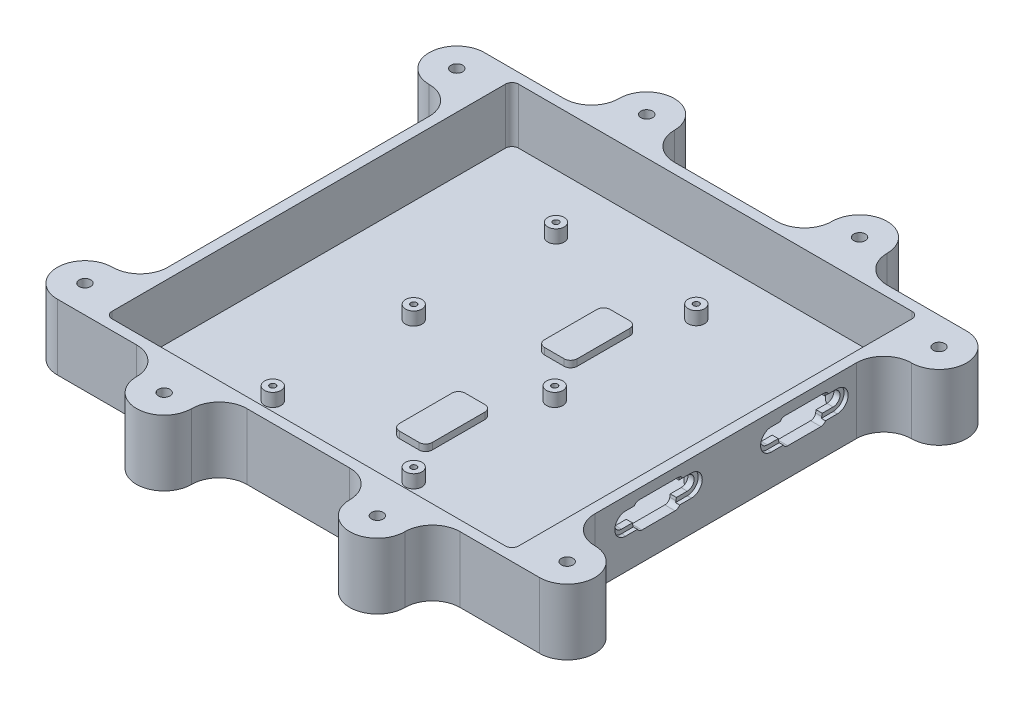
from build123d import *

# Parameters (mm, degrees)
SKETCH1_W                 = 165.1
SKETCH1_H                 = 165.1
BOSS_EXTRUDE1_DEPTH       = 25.4
SHELL1_T                  = -3.9624
SKETCH4_R                 = 3.175
BOSS_EXTRUDE2_DEPTH       = 5.08
FILLET1_R                 = 2.54
BOSS_EXTRUDE3_DEPTH       = 25.4
SKETCH77_W                = 12.7
SKETCH77_H                = 25.4
BOSS_EXTRUDE5_DEPTH       = 2.54
FILLET27_R                = 2.54
F_4_40_TAPPED_HOLE1_D     = 2.2606
F_4_40_TAPPED_HOLE1_DEPTH = 6.35
F_4_40_TAPPED_HOLE1_TIP   = 0.679152758
CUT_EXTRUDE6_DEPTH        = 3.9624
CUT_EXTRUDE7_DEPTH        = 3.9624
CUT_EXTRUDE8_DEPTH        = 1.5875
F_8_CLEARANCE_HOLE1_D     = 4.4958
F_8_CLEARANCE_HOLE1_DEPTH = 8.89
F_8_CLEARANCE_HOLE1_TIP   = 1.350674586


with BuildPart() as part:
    # Sketch1 → Boss-Extrude1 (new body)
    with BuildSketch(Plane(origin=(0, 0, 0), x_dir=(1, 0, 0), z_dir=(0, 1, 0))):
        with Locations((82.55, 82.55)):
            Rectangle(SKETCH1_W, SKETCH1_H)
    extrude(amount=BOSS_EXTRUDE1_DEPTH)

    # Shell1
    shell1_openings = [part.faces().sort_by_distance(p)[0] for p in [
        (82.55, 25.4, -82.55),
    ]]
    offset(amount=SHELL1_T, openings=shell1_openings, kind=Kind.INTERSECTION)

    # Sketch4 → Boss-Extrude2 (add)
    with BuildSketch(Plane(origin=(0, 3.9624, 0), x_dir=(1, 0, 0), z_dir=(0, 1, 0))):
        with Locations(Location((43.589230059, 29.02204, 0), (0, 0, 90))):
            Circle(SKETCH4_R)
        with Locations(Location((98.08718, 29.02204, 0), (0, 0, 90))):
            Circle(SKETCH4_R)
        with Locations(Location((152.58796, 29.02204, 0), (0, 0, 90))):
            Circle(SKETCH4_R)
        with Locations(Location((152.58796, 83.52282, 0), (0, 0, 90))):
            Circle(SKETCH4_R)
        with Locations(Location((43.589230059, 83.52282, 0), (0, 0, 90))):
            Circle(SKETCH4_R)
        with Locations(Location((98.08718, 83.52282, 0), (0, 0, 90))):
            Circle(SKETCH4_R)
        with Locations(Location((152.58796, 138.27252, 0), (0, 0, 90))):
            Circle(SKETCH4_R)
        with Locations(Location((98.08718, 138.27252, 0), (0, 0, 90))):
            Circle(SKETCH4_R)
        with Locations(Location((43.589230059, 138.52398, 0), (0, 0, 90))):
            Circle(SKETCH4_R)
    extrude(amount=BOSS_EXTRUDE2_DEPTH)

    # Fillet1
    fillet1_edges = [part.edges().sort_by_distance(p)[0] for p in [
        (3.9624, 14.6812, -161.1376),
        (3.9624, 14.6812, -3.9624),
        (161.1376, 14.6812, -3.9624),
        (161.1376, 14.6812, -161.1376),
    ]]
    fillet(fillet1_edges, radius=FILLET1_R)

    # Sketch5 → Boss-Extrude3 (add)
    with BuildSketch(Plane.XZ):
        with BuildLine():
            ThreePointArc((175.768, -21.336), (186.436, -10.668), (175.768, 0))
            Line((175.768, 0), (165.1, 0))
            Line((165.1, 0), (165.1, -32.004))
            ThreePointArc((165.1, -32.004), (168.224584858, -24.460584858), (175.768, -21.336))
        make_face()
        with BuildLine():
            Line((0, 0), (-10.668, 0))
            ThreePointArc((-10.668, 0), (-21.336, -10.668), (-10.668, -21.336))
            ThreePointArc((-10.668, -21.336), (-3.124584858, -24.460584858), (0, -32.004))
            Line((0, -32.004), (0, 0))
        make_face()
        with BuildLine():
            ThreePointArc((-10.668, -143.764), (-21.336, -154.432), (-10.668, -165.1))
            Line((-10.668, -165.1), (0, -165.1))
            Line((0, -165.1), (0, -133.096))
            ThreePointArc((0, -133.096), (-3.124584858, -140.639415142), (-10.668, -143.764))
        make_face()
        with BuildLine():
            Line((165.1, -165.1), (175.768, -165.1))
            ThreePointArc((175.768, -165.1), (186.436, -154.432), (175.768, -143.764))
            ThreePointArc((175.768, -143.764), (168.224584858, -140.639415142), (165.1, -133.096))
            Line((165.1, -133.096), (165.1, -165.1))
        make_face()
        with BuildLine():
            ThreePointArc((30.607, 10.668), (27.482415142, 3.124584858), (19.939, 0))
            Line((19.939, 0), (62.611, 0))
            ThreePointArc((62.611, 0), (55.067584858, 3.124584858), (51.943, 10.668))
            ThreePointArc((51.943, 10.668), (41.275, 21.336), (30.607, 10.668))
        make_face()
        with BuildLine():
            ThreePointArc((113.03, 10.668), (109.905415142, 3.124584858), (102.362, 0))
            Line((102.362, 0), (145.034, 0))
            ThreePointArc((145.034, 0), (137.490584858, 3.124584858), (134.366, 10.668))
            ThreePointArc((134.366, 10.668), (123.698, 21.336), (113.03, 10.668))
        make_face()
        with BuildLine():
            ThreePointArc((134.366, -175.768), (137.490584858, -168.224584858), (145.034, -165.1))
            Line((145.034, -165.1), (102.362, -165.1))
            ThreePointArc((102.362, -165.1), (109.905415142, -168.224584858), (113.03, -175.768))
            ThreePointArc((113.03, -175.768), (123.698, -186.436), (134.366, -175.768))
        make_face()
        with BuildLine():
            ThreePointArc((52.07, -175.768), (55.194584858, -168.224584858), (62.738, -165.1))
            Line((62.738, -165.1), (20.066, -165.1))
            ThreePointArc((20.066, -165.1), (27.609415142, -168.224584858), (30.734, -175.768))
            ThreePointArc((30.734, -175.768), (41.402, -186.436), (52.07, -175.768))
        make_face()
    extrude(amount=-BOSS_EXTRUDE3_DEPTH)

    # Sketch77 → Boss-Extrude5 (add)
    with BuildSketch(Plane(origin=(0, 3.9624, 0), x_dir=(1, 0, 0), z_dir=(0, 1, 0))):
        with Locations((84.52866, 53.55082)):
            Rectangle(SKETCH77_W, SKETCH77_H)
        with Locations((84.52866, 109.601)):
            Rectangle(SKETCH77_W, SKETCH77_H)
    extrude(amount=BOSS_EXTRUDE5_DEPTH)

    # Fillet27
    fillet27_edges = [part.edges().sort_by_distance(p)[0] for p in [
        (78.17866, 5.2324, -66.25082),
        (78.17866, 5.2324, -40.85082),
        (90.87866, 5.2324, -40.85082),
        (90.87866, 5.2324, -66.25082),
        (78.17866, 5.2324, -122.301),
        (78.17866, 5.2324, -96.901),
        (90.87866, 5.2324, -96.901),
        (90.87866, 5.2324, -122.301),
    ]]
    fillet(fillet27_edges, radius=FILLET27_R)

    # #4-40 Tapped Hole1
    with Locations(Plane(origin=(0, 9.0424, 0), x_dir=(1, 0, 0), z_dir=(0, 1, 0))):
        with Locations((152.58796, 29.02204), (152.58796, 83.52282), (152.58796, 138.27252), (98.08718, 138.27252), (98.08718, 83.52282), (98.08718, 29.02204), (43.589230059, 29.02204), (43.589230059, 83.52282), (43.589230059, 138.52398)):
            Hole(F_4_40_TAPPED_HOLE1_D / 2, depth=F_4_40_TAPPED_HOLE1_DEPTH)
            with Locations((0, 0, -(F_4_40_TAPPED_HOLE1_DEPTH + F_4_40_TAPPED_HOLE1_TIP / 2))):  # 118° drill point
                Cone(0, F_4_40_TAPPED_HOLE1_D / 2, F_4_40_TAPPED_HOLE1_TIP, mode=Mode.SUBTRACT)

    # Sketch86 → Cut-Extrude6 (cut)
    with BuildSketch(Plane(origin=(165.1, 0, 0), x_dir=(0, 0, -1), z_dir=(1, 0, 0))):
        with BuildLine():
            Line((50.240011813, 10.88644), (63.043988187, 10.88644))
            ThreePointArc((63.043988187, 10.88644), (64.296254152, 11.342227537), (64.962570955, 12.496322093))
            Line((64.962570955, 12.496322093), (66.146292768, 19.209542093))
            ThreePointArc((66.146292768, 19.209542093), (65.720102463, 20.800105965), (64.22771, 21.49602))
            Line((64.22771, 21.49602), (49.05629, 21.49602))
            ThreePointArc((49.05629, 21.49602), (47.563897537, 20.800105965), (47.137707232, 19.209542093))
            Line((47.137707232, 19.209542093), (48.321429045, 12.496322093))
            ThreePointArc((48.321429045, 12.496322093), (48.987745848, 11.342227537), (50.240011813, 10.88644))
        make_face()
    cut_extrude6 = extrude(amount=-CUT_EXTRUDE6_DEPTH, mode=Mode.SUBTRACT)

    # Sketch87 → Cut-Extrude7 (cut)
    with BuildSketch(Plane(origin=(165.1, 0, 0), x_dir=(0, 0, -1), z_dir=(1, 0, 0))):
        with BuildLine():
            Line((43.942, 18.85823), (69.342, 18.85823))
            ThreePointArc((69.342, 18.85823), (72.009, 16.19123), (69.342, 13.52423))
            Line((69.342, 13.52423), (43.942, 13.52423))
            ThreePointArc((43.942, 13.52423), (41.275, 16.19123), (43.942, 18.85823))
        make_face()
    cut_extrude7 = extrude(amount=-CUT_EXTRUDE7_DEPTH, mode=Mode.SUBTRACT)

    # Sketch88 → Cut-Extrude8 (cut)
    with BuildSketch(Plane(origin=(165.1, 0, 0), x_dir=(0, 0, -1), z_dir=(1, 0, 0))):
        with BuildLine():
            Line((43.942, 20.40763), (69.342, 20.40763))
            ThreePointArc((69.342, 20.40763), (73.5584, 16.19123), (69.342, 11.97483))
            Line((69.342, 11.97483), (43.942, 11.97483))
            ThreePointArc((43.942, 11.97483), (39.7256, 16.19123), (43.942, 20.40763))
        make_face()
    cut_extrude8 = extrude(amount=-CUT_EXTRUDE8_DEPTH, mode=Mode.SUBTRACT)

    # Mirror1: Cut-Extrude6, Cut-Extrude7, Cut-Extrude8 across plane
    add(cut_extrude6.mirror(Plane.XY.offset(-84.836)), mode=Mode.SUBTRACT)
    add(cut_extrude7.mirror(Plane.XY.offset(-84.836)), mode=Mode.SUBTRACT)
    add(cut_extrude8.mirror(Plane.XY.offset(-84.836)), mode=Mode.SUBTRACT)

    # #8 Clearance Hole1
    with Locations(Plane(origin=(0, 25.4, 0), x_dir=(1, 0, 0), z_dir=(0, 1, 0))):
        with Locations((41.402, 175.768), (123.698, 175.768), (175.768, 154.432), (175.768, 10.668), (123.698, -10.668), (41.275, -10.668), (-10.668, 10.668), (-10.668, 154.432)):
            Hole(F_8_CLEARANCE_HOLE1_D / 2, depth=F_8_CLEARANCE_HOLE1_DEPTH)
            with Locations((0, 0, -(F_8_CLEARANCE_HOLE1_DEPTH + F_8_CLEARANCE_HOLE1_TIP / 2))):  # 118° drill point
                Cone(0, F_8_CLEARANCE_HOLE1_D / 2, F_8_CLEARANCE_HOLE1_TIP, mode=Mode.SUBTRACT)


solid = part.part
